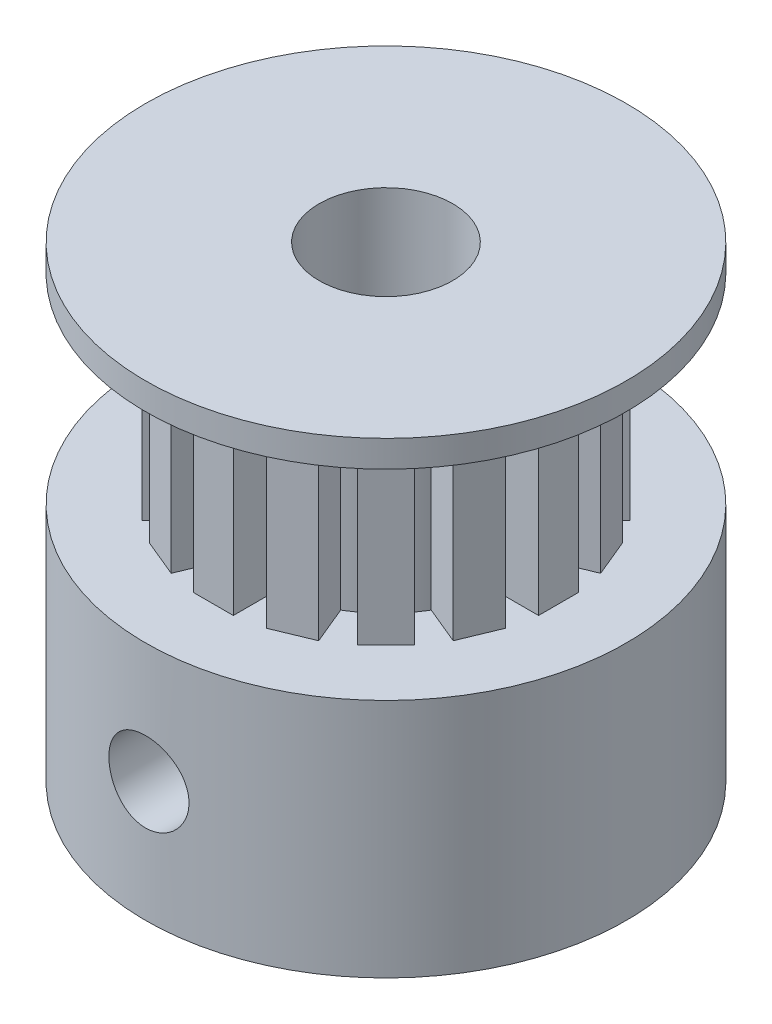
from build123d import *

# Parameters (mm, degrees)
ESBO_O2_R                  = 2.5
CORTE_EXTRUS_O1_DEPTH      = 20
RESSALTO_EXTRUS_O1_DEPTH   = 8.5
CORTE_EXTRUS_O2_DEPTH      = 10
CORTE_EXTRUS_O2_DEPTH_BACK = 10
ESBO_O5_R                  = 1.5


with BuildPart() as part:
    # Esboço1 → Revolução1 (revolve)
    with BuildSketch(Plane.XY):
        Polygon((0, 17.5), (0, 0), (-5, 0), (-9, 0), (-9, 8), (-9, 9), (-5, 9), (-5, 16.5), (-9, 16.5), (-9, 17.5), align=None)
    revolve(axis=Axis((0, 17.5, 0), (0, -1, 0)))

    # Esboço2 → Corte-extrusão1 (cut)
    with BuildSketch(Plane(origin=(0, 17.5, 0), x_dir=(1, 0, 0), z_dir=(0, 1, 0))):
        with Locations(Location((0, 0, 0), (0, 0, 180))):
            Circle(ESBO_O2_R)
    extrude(amount=-CORTE_EXTRUS_O1_DEPTH, mode=Mode.SUBTRACT)

    # Esboço4 → Ressalto-extrusão1 (add)
    with BuildSketch(Plane(origin=(0, 17.5, 0), x_dir=(1, 0, 0), z_dir=(0, 1, 0))):
        Polygon((0.75, 2.711240108), (0.539299188, 2.711240108), (1.535794152, 2.298478379), (1.38680618, 2.447466352), (2.135819299, 3.196479471), (3.167059402, 5.686113314), (1.781240103, 6.260138462), (0.75, 3.770504619), align=None)
        Polygon((1.73045632, 2.217846669), (1.535794152, 2.298478379), (2.298478379, 1.535794152), (2.217846669, 1.73045632), (3.196479471, 2.135819299), (5.101962719, 4.041302547), (4.041302547, 5.101962719), (2.135819299, 3.196479471), align=None)
        Polygon((2.447466352, 1.38680618), (2.298478379, 1.535794152), (2.711240108, 0.539299188), (2.711240108, 0.75), (3.770504619, 0.75), (6.260138462, 1.781240103), (5.686113314, 3.167059402), (3.196479471, 2.135819299), align=None)
        Polygon((0.539299188, 2.711240108), (0.344637021, 2.791871818), (0.75, 3.770504619), (0.75, 6.465264872), (-0.75, 6.465264872), (-0.75, 3.770504619), (-0.344637021, 2.791871818), (-0.539299188, 2.711240108), align=None)
        Polygon((-1.535794152, 2.298478379), (-0.539299188, 2.711240108), (-0.75, 2.711240108), (-0.75, 3.770504619), (-1.781240103, 6.260138462), (-3.167059402, 5.686113314), (-2.135819299, 3.196479471), (-1.38680618, 2.447466352), align=None)
        Polygon((-2.298478379, 1.535794152), (-1.535794152, 2.298478379), (-1.73045632, 2.217846669), (-2.135819299, 3.196479471), (-4.041302547, 5.101962719), (-5.101962719, 4.041302547), (-3.196479471, 2.135819299), (-2.217846669, 1.73045632), align=None)
        Polygon((-2.711240108, 0.539299188), (-2.298478379, 1.535794152), (-2.447466352, 1.38680618), (-3.196479471, 2.135819299), (-5.686113314, 3.167059402), (-6.260138462, 1.781240103), (-3.770504619, 0.75), (-2.711240108, 0.75), align=None)
        Polygon((-2.711240108, -0.539299188), (-2.711240108, 0.539299188), (-2.791871818, 0.344637021), (-3.770504619, 0.75), (-6.465264872, 0.75), (-6.465264872, -0.75), (-3.770504619, -0.75), (-2.791871818, -0.344637021), align=None)
        Polygon((-2.298478379, -1.535794152), (-2.711240108, -0.539299188), (-2.711240108, -0.75), (-3.770504619, -0.75), (-6.260138462, -1.781240103), (-5.686113314, -3.167059402), (-3.196479471, -2.135819299), (-2.447466352, -1.38680618), align=None)
        Polygon((-1.535794152, -2.298478379), (-2.298478379, -1.535794152), (-2.217846669, -1.73045632), (-3.196479471, -2.135819299), (-5.101962719, -4.041302547), (-4.041302547, -5.101962719), (-2.135819299, -3.196479471), (-1.73045632, -2.217846669), align=None)
        Polygon((-0.539299188, -2.711240108), (-1.535794152, -2.298478379), (-1.38680618, -2.447466352), (-2.135819299, -3.196479471), (-3.167059402, -5.686113314), (-1.781240103, -6.260138462), (-0.75, -3.770504619), (-0.75, -2.711240108), align=None)
        Polygon((0.344637021, -2.791871818), (0.539299188, -2.711240108), (-0.539299188, -2.711240108), (-0.344637021, -2.791871818), (-0.75, -3.770504619), (-0.75, -6.465264872), (0.75, -6.465264872), (0.75, -3.770504619), align=None)
        Polygon((1.38680618, -2.447466352), (1.535794152, -2.298478379), (0.539299188, -2.711240108), (0.75, -2.711240108), (0.75, -3.770504619), (1.781240103, -6.260138462), (3.167059402, -5.686113314), (2.135819299, -3.196479471), align=None)
        Polygon((2.217846669, -1.73045632), (2.298478379, -1.535794152), (1.535794152, -2.298478379), (1.73045632, -2.217846669), (2.135819299, -3.196479471), (4.041302547, -5.101962719), (5.101962719, -4.041302547), (3.196479471, -2.135819299), align=None)
        Polygon((2.711240108, -0.75), (2.711240108, -0.539299188), (2.298478379, -1.535794152), (2.447466352, -1.38680618), (3.196479471, -2.135819299), (5.686113314, -3.167059402), (6.260138462, -1.781240103), (3.770504619, -0.75), align=None)
        Polygon((2.791871818, 0.344637021), (2.711240108, 0.539299188), (2.711240108, -0.539299188), (2.791871818, -0.344637021), (3.770504619, -0.75), (6.465264872, -0.75), (6.465264872, 0.75), (3.770504619, 0.75), align=None)
    extrude(amount=-RESSALTO_EXTRUS_O1_DEPTH)

    # Esboço5 → Corte-extrusão2 (cut, two sides: drawn at the far end of the back side and taken through both)
    with BuildSketch(Plane.XY.offset(-CORTE_EXTRUS_O2_DEPTH_BACK)):
        with Locations(Location((0, 4.5, 0), (0, 0, 180))):
            Circle(ESBO_O5_R)
    extrude(amount=CORTE_EXTRUS_O2_DEPTH + CORTE_EXTRUS_O2_DEPTH_BACK, mode=Mode.SUBTRACT)


solid = part.part
